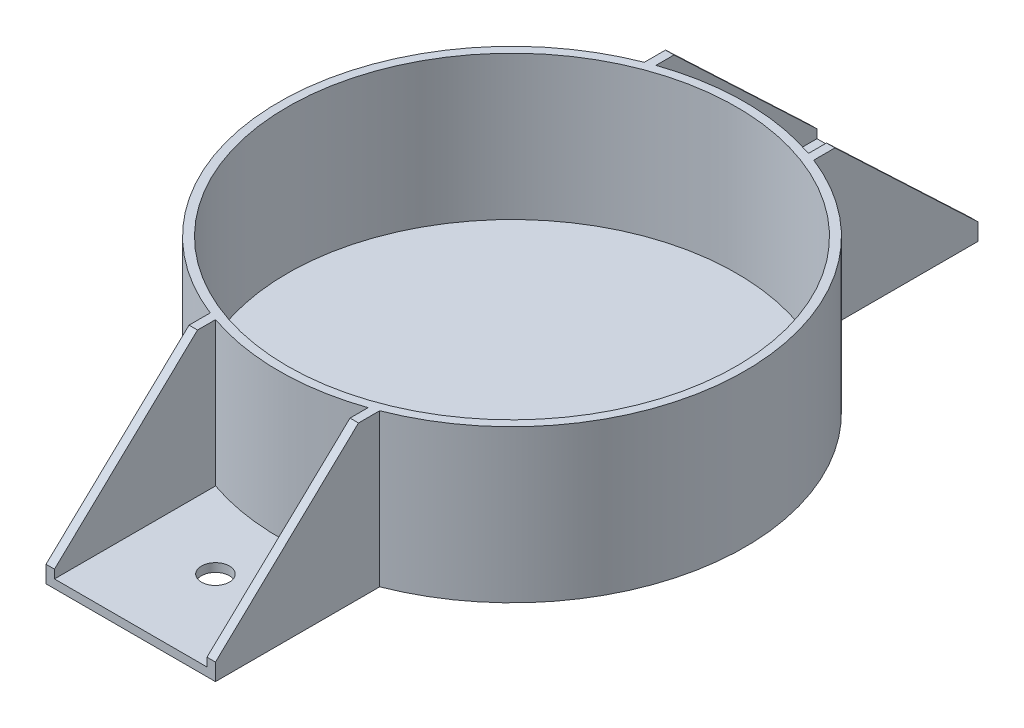
from build123d import *

# Parameters (mm, degrees)
EXTRUDE_2_DEPTH      = 1
SKETCH_6_R           = 27.5
SKETCH_6_R_2         = 26.5
EXTRUDE_3_DEPTH      = 17
EXTRUDE_4_REACH      = 97.814
EXTRUDE_4_END_RADIUS = 27.5
SKETCH_8_W           = 1
SKETCH_8_H           = 17
CUT_EXTRUDE_2_DEPTH  = 20
SKETCH_11_R          = 1.65
CUT_EXTRUDE_3_DEPTH  = 20


with BuildPart() as part:
    # 草图3 → 凸台-拉伸2 (new body)
    with BuildSketch(Plane(origin=(0, 0, 0), x_dir=(1, 0, 0), z_dir=(0, 1, 0))):
        with BuildLine():
            Line((-10, 25.617376915), (-10, 45))
            Line((-10, 45), (10, 45))
            Line((10, 45), (10, 25.617376915))
            ThreePointArc((10, 25.617376915), (27.5, 0), (10, -25.617376915))
            Line((10, -25.617376915), (10, -45))
            Line((10, -45), (-10, -45))
            Line((-10, -45), (-10, -25.617376915))
            ThreePointArc((-10, -25.617376915), (-27.5, 0), (-10, 25.617376915))
        make_face()
    extrude(amount=EXTRUDE_2_DEPTH)

    # 草图6 → 凸台-拉伸3 (add)
    with BuildSketch(Plane(origin=(0, 1, 0), x_dir=(1, 0, 0), z_dir=(0, 1, 0))):
        with Locations(Location((0, 0, 0), (0, 0, 68.676313737))):
            Circle(SKETCH_6_R)
        with Locations(Location((0, 0, 0), (0, 0, 270))):
            Circle(SKETCH_6_R_2, mode=Mode.SUBTRACT)
    extrude(amount=EXTRUDE_3_DEPTH)

    # 凸台-拉伸4: up to this cylinder (the profile starts outside it)
    extrude_4_end = Plane(origin=(0, 9.5, 0), z_dir=(0, -1, 0)) * Cylinder(EXTRUDE_4_END_RADIUS, 251.628, mode=Mode.PRIVATE)
    # 草图8 → 凸台-拉伸4 (add, up to the surface)
    with BuildSketch(Plane.XY.offset(45), mode=Mode.PRIVATE) as extrude_4_sk1:
        with Locations((-9.5, 9.5)):
            Rectangle(SKETCH_8_W, SKETCH_8_H)
    extrude_4_tool1 = extrude(extrude_4_sk1.sketch, amount=-EXTRUDE_4_REACH, mode=Mode.PRIVATE) - extrude_4_end
    # 草图8 → 凸台-拉伸4 (add, up to the surface)
    with BuildSketch(Plane.XY.offset(45), mode=Mode.PRIVATE) as extrude_4_sk2:
        with Locations((9.5, 9.5)):
            Rectangle(SKETCH_8_W, SKETCH_8_H)
    extrude_4_tool2 = extrude(extrude_4_sk2.sketch, amount=-EXTRUDE_4_REACH, mode=Mode.PRIVATE) - extrude_4_end
    extrude_4 = extrude_4_tool1.solids().sort_by_distance((-9.5, 9.5, 45))[0] + extrude_4_tool2.solids().sort_by_distance((9.5, 9.5, 45))[0]
    add(extrude_4)

    # 草图9 → 切除-拉伸2 (cut)
    with BuildSketch(Plane.ZY.offset(10)):
        Polygon((28.117376915, 18), (45, 2), (45, 18), align=None)
    cut_extrude_2 = extrude(amount=-CUT_EXTRUDE_2_DEPTH, mode=Mode.SUBTRACT)

    # 镜向1: 凸台-拉伸4, 切除-拉伸2 across plane
    add(extrude_4.mirror(Plane.XY))
    add(cut_extrude_2.mirror(Plane.XY), mode=Mode.SUBTRACT)

    # 草图11 → 切除-拉伸3 (cut)
    with BuildSketch(Plane(origin=(0, 1, 0), x_dir=(1, 0, 0), z_dir=(0, 1, 0))):
        with Locations(Location((0, 35, 0), (0, 0, 270))):
            Circle(SKETCH_11_R)
        with Locations(Location((0, -35, 0), (0, 0, 270))):
            Circle(SKETCH_11_R)
    extrude(amount=-CUT_EXTRUDE_3_DEPTH, mode=Mode.SUBTRACT)


solid = part.part
